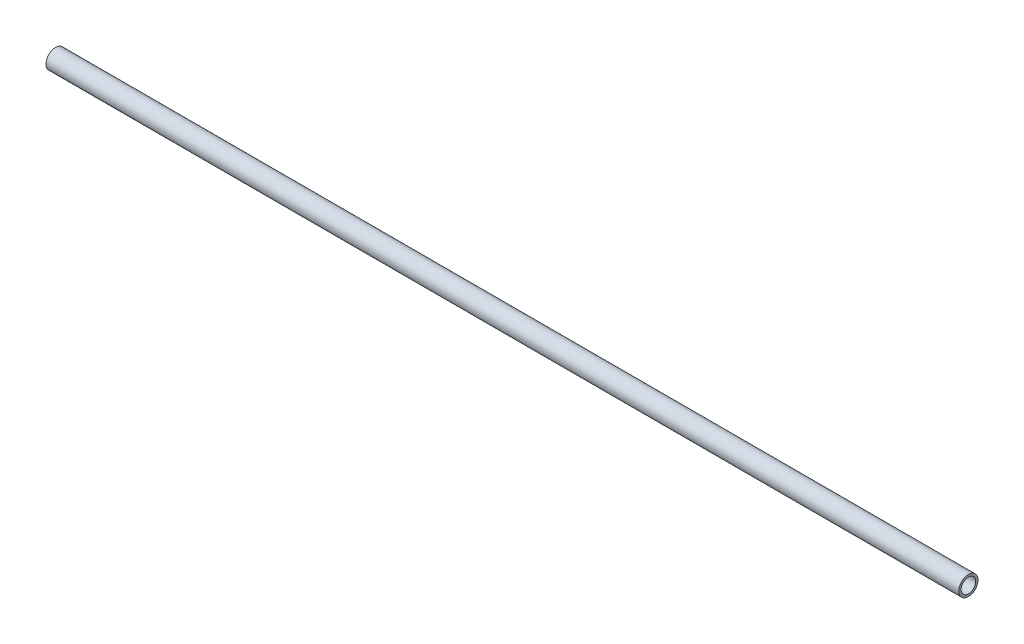
from build123d import *

# Parameters (mm, degrees)
SKETCH1_R           = 12.7
SKETCH1_R_2         = 9.652
BOSS_EXTRUDE1_DEPTH = 1210


with BuildPart() as part:
    # Sketch1 → Boss-Extrude1 (new body)
    with BuildSketch(Plane(origin=(0, 0, 0), x_dir=(0, 0, -1), z_dir=(1, 0, 0))):
        Circle(SKETCH1_R)
        Circle(SKETCH1_R_2, mode=Mode.SUBTRACT)
    extrude(amount=BOSS_EXTRUDE1_DEPTH)


solid = part.part
